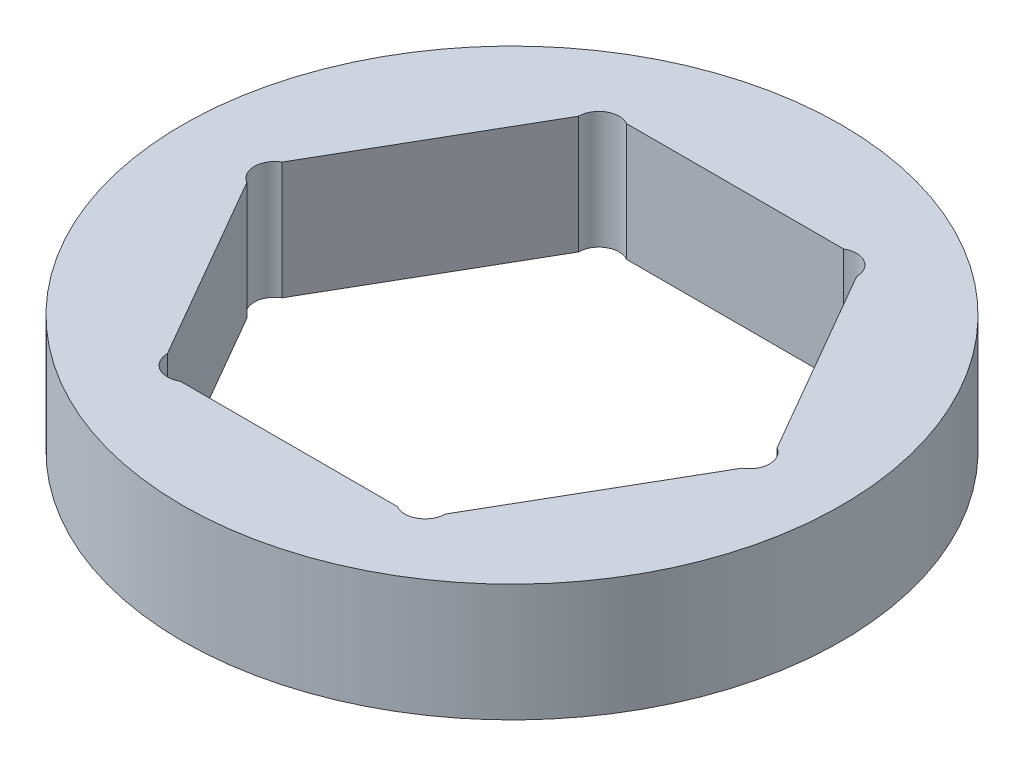
from build123d import *

# Parameters (mm, degrees)
SKETCH1_R           = 9.7536
BOSS_EXTRUDE1_DEPTH = 3.4798


with BuildPart() as part:
    # Sketch1 → Boss-Extrude1 (new body)
    with BuildSketch(Plane(origin=(0, 0, 0), x_dir=(1, 0, 0), z_dir=(0, 1, 0))):
        with Locations(Location((0, 0, 0), (0, 0, 270))):
            Circle(SKETCH1_R)
        with BuildLine():
            ThreePointArc((3.812821178, 6.604), (4.03243642, 6.384384758), (4.112821178, 6.084384758))
            Line((4.112821178, 6.084384758), (7.325642355, 0.519615242))
            ThreePointArc((7.325642355, 0.519615242), (7.545257598, 0.3), (7.625642355, 0))
            ThreePointArc((7.625642355, 0), (7.545257598, -0.3), (7.325642355, -0.519615242))
            Line((7.325642355, -0.519615242), (4.112821178, -6.084384758))
            ThreePointArc((4.112821178, -6.084384758), (4.03243642, -6.384384758), (3.812821178, -6.604))
            ThreePointArc((3.812821178, -6.604), (3.512821178, -6.684384758), (3.212821178, -6.604))
            Line((3.212821178, -6.604), (-3.212821178, -6.604))
            ThreePointArc((-3.212821178, -6.604), (-3.512821178, -6.684384758), (-3.812821178, -6.604))
            ThreePointArc((-3.812821178, -6.604), (-4.03243642, -6.384384758), (-4.112821178, -6.084384758))
            Line((-4.112821178, -6.084384758), (-7.325642355, -0.519615242))
            ThreePointArc((-7.325642355, -0.519615242), (-7.545257598, -0.3), (-7.625642355, 0))
            ThreePointArc((-7.625642355, 0), (-7.545257598, 0.3), (-7.325642355, 0.519615242))
            Line((-7.325642355, 0.519615242), (-4.112821178, 6.084384758))
            ThreePointArc((-4.112821178, 6.084384758), (-4.03243642, 6.384384758), (-3.812821178, 6.604))
            ThreePointArc((-3.812821178, 6.604), (-3.512821178, 6.684384758), (-3.212821178, 6.604))
            Line((-3.212821178, 6.604), (3.212821178, 6.604))
            ThreePointArc((3.212821178, 6.604), (3.512821178, 6.684384758), (3.812821178, 6.604))
        make_face(mode=Mode.SUBTRACT)
    extrude(amount=BOSS_EXTRUDE1_DEPTH)


solid = part.part
